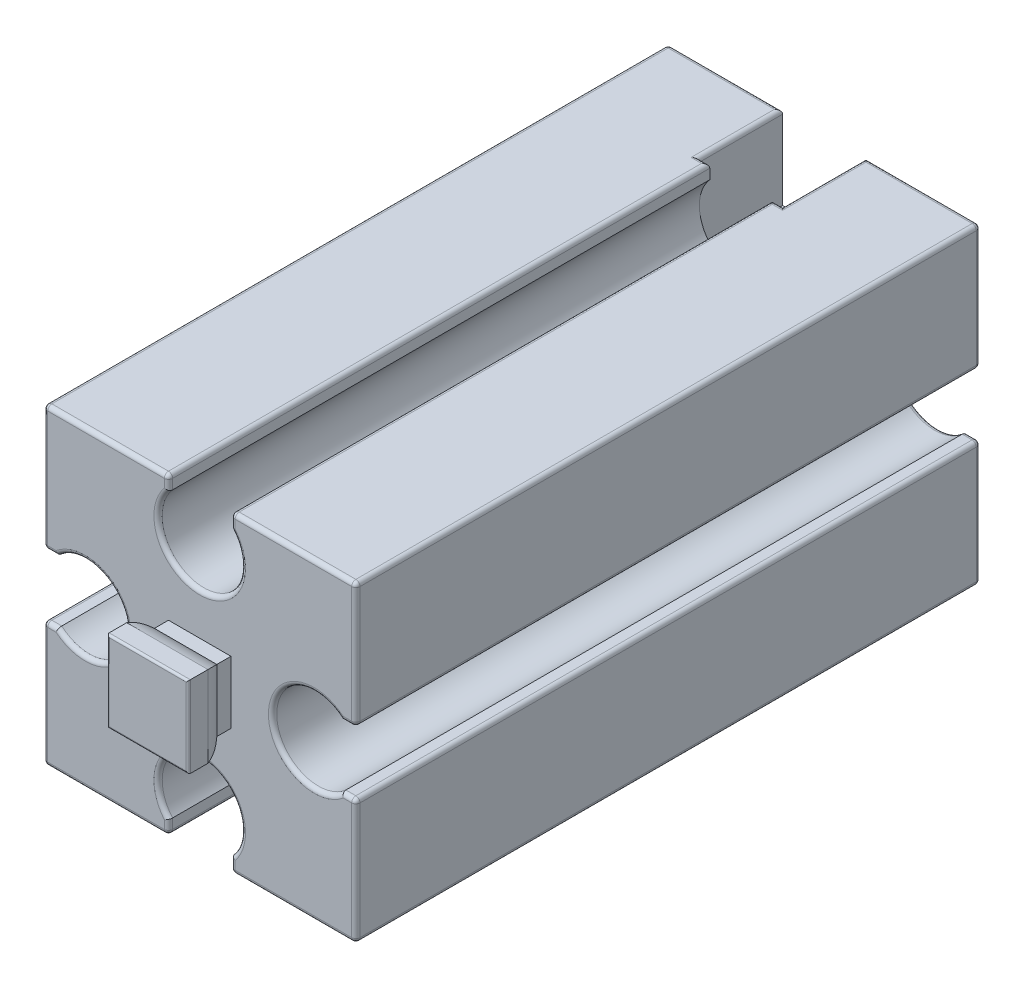
from build123d import *

# Parameters (mm, degrees)
SKETCH_1_W                      = 15
SKETCH_1_H                      = 15
EXTRUDE_1_DEPTH                 = 30
EXTRUDE_2_DEPTH                 = 1.5
EXTRUDE_2_DEPTH_BACK            = 1.5
SKETCH_2_W                      = 3
SKETCH_2_H                      = 1
EXTRUDE_3_DEPTH                 = 3
EXTRUDE_3_DEPTH_BACK            = 3
CUT_EXTRUDE_2_DEPTH             = 32.819805153
SKETCH_6_W                      = 4
SKETCH_6_H                      = 4
CUT_EXTRUDE_3_DEPTH             = 4
SKETCH_9_W                      = 4
SKETCH_9_H                      = 4
CUT_EXTRUDE_5_DEPTH             = 4
CUT_EXTRUDE_6_DEPTH             = 32.819805153
CUT_EXTRUDE_6_DEPTH_BACK        = 32.819805153
CUT_EXTRUDE_7_REACH             = 33.82
CUT_EXTRUDE_7_DIRECTION_2_REACH = 33.82
FILLET_2_R                      = 0.1
FILLET_3_R                      = 0.2


with BuildPart() as part:
    # 草图1 → 凸台-拉伸1 (new body)
    with BuildSketch(Plane.XY):
        Rectangle(SKETCH_1_W, SKETCH_1_H)
    extrude(amount=-EXTRUDE_1_DEPTH)

    # 草图2 → 凸台-拉伸2 (add, two sides: drawn at the far end of the back side and taken through both)
    with BuildSketch(Plane(origin=(0, 0, 0), x_dir=(1, 0, 0), z_dir=(0, 1, 0)).offset(-EXTRUDE_2_DEPTH_BACK)):
        with Locations((0, -0.5)):
            Rectangle(SKETCH_2_W, SKETCH_2_H)
    extrude(amount=EXTRUDE_2_DEPTH + EXTRUDE_2_DEPTH_BACK)

    # 草图3 → 凸台-拉伸3 (add, two sides: drawn at the far end of the back side and taken through both)
    with BuildSketch(Plane(origin=(0, 0, 0), x_dir=(1, 0, 0), z_dir=(0, 1, 0)).offset(-EXTRUDE_3_DEPTH_BACK)):
        with BuildLine():
            Line((-1.95, -2.5), (1.95, -2.5))
            Line((1.95, -2.5), (1.95, -1.555590279))
            ThreePointArc((1.95, -1.555590279), (1.780042303, -1.088161527), (1.5, -0.677124344))
            Line((1.5, -0.677124344), (-1.5, -0.677124344))
            ThreePointArc((-1.5, -0.677124344), (-1.780042303, -1.088161527), (-1.95, -1.555590279))
            Line((-1.95, -1.555590279), (-1.95, -2.5))
        make_face()
    extrude(amount=EXTRUDE_3_DEPTH + EXTRUDE_3_DEPTH_BACK)

    # 草图5 → 切除-拉伸2 (cut, through all)
    with BuildSketch(Plane.XY):
        with BuildLine():
            Line((-1.5, -7.5), (1.5, -7.5))
            Line((1.5, -7.5), (1.5, -6.822875656))
            ThreePointArc((1.5, -6.822875656), (0, -3.5), (-1.5, -6.822875656))
            Line((-1.5, -6.822875656), (-1.5, -7.5))
        make_face()
        with BuildLine():
            Line((1.5, 7.5), (1.5, 6.822875656))
            ThreePointArc((1.5, 6.822875656), (0, 3.5), (-1.5, 6.822875656))
            Line((-1.5, 6.822875656), (-1.5, 7.5))
            Line((-1.5, 7.5), (1.5, 7.5))
        make_face()
        with BuildLine():
            Line((-7.5, 1.5), (-6.822875656, 1.5))
            ThreePointArc((-6.822875656, 1.5), (-3.5, 0), (-6.822875656, -1.5))
            Line((-6.822875656, -1.5), (-7.5, -1.5))
            Line((-7.5, -1.5), (-7.5, 1.5))
        make_face()
        with BuildLine():
            Line((7.5, -1.5), (6.822875656, -1.5))
            ThreePointArc((6.822875656, -1.5), (3.5, 0), (6.822875656, 1.5))
            Line((6.822875656, 1.5), (7.5, 1.5))
            Line((7.5, 1.5), (7.5, -1.5))
        make_face()
    extrude(amount=-CUT_EXTRUDE_2_DEPTH, mode=Mode.SUBTRACT)

    # 草图6 → 切除-拉伸3 (cut)
    with BuildSketch(Plane(origin=(0, 7.5, 0), x_dir=(-1, 0, 0), z_dir=(0, 1, 0))):
        with Locations((0, -28)):
            Rectangle(SKETCH_6_W, SKETCH_6_H)
    extrude(amount=-CUT_EXTRUDE_3_DEPTH, mode=Mode.SUBTRACT)

    # 草图9 → 切除-拉伸5 (cut)
    with BuildSketch(Plane.XZ.offset(7.5)):
        with Locations((0, -28)):
            Rectangle(SKETCH_9_W, SKETCH_9_H)
    extrude(amount=-CUT_EXTRUDE_5_DEPTH, mode=Mode.SUBTRACT)

    # 草图11 → 切除-拉伸6 (cut, two sides: drawn at the far end of the back side and taken through both)
    with BuildSketch(Plane(origin=(0, 0, 0), x_dir=(1, 0, 0), z_dir=(0, 1, 0)).offset(-CUT_EXTRUDE_6_DEPTH_BACK)):
        with BuildLine():
            Line((-1.5, 30), (1.5, 30))
            Line((1.5, 30), (1.5, 29.322875656))
            ThreePointArc((1.5, 29.322875656), (0, 26), (-1.5, 29.322875656))
            Line((-1.5, 29.322875656), (-1.5, 30))
        make_face()
    extrude(amount=CUT_EXTRUDE_6_DEPTH + CUT_EXTRUDE_6_DEPTH_BACK, mode=Mode.SUBTRACT)

    # 草图12 → 切除-拉伸7 (cut, up to next)
    with BuildSketch(Plane(origin=(0, 0, 0), x_dir=(0, 0, -1), z_dir=(1, 0, 0)), mode=Mode.PRIVATE) as cut_extrude_7_sk1:
        with BuildLine():
            Line((-2.5, 3), (-2.5, 1.95))
            Line((-2.5, 1.95), (-1.555590279, 1.95))
            ThreePointArc((-1.555590279, 1.95), (-1.088161527, 1.780042303), (-0.677124344, 1.5))
            Line((-0.677124344, 1.5), (-0.677124344, 3))
            Line((-0.677124344, 3), (-2.5, 3))
        make_face()
    cut_extrude_7_tool1 = extrude(cut_extrude_7_sk1.sketch, amount=-CUT_EXTRUDE_7_REACH, mode=Mode.PRIVATE) & part.part
    # 草图12 → 切除-拉伸7 (cut, up to next)
    with BuildSketch(Plane(origin=(0, 0, 0), x_dir=(0, 0, -1), z_dir=(1, 0, 0)), mode=Mode.PRIVATE) as cut_extrude_7_sk2:
        with BuildLine():
            Line((-2.5, -1.95), (-1.555590279, -1.95))
            ThreePointArc((-1.555590279, -1.95), (-1.088161527, -1.780042303), (-0.677124344, -1.5))
            Line((-0.677124344, -1.5), (-0.677124344, -3))
            Line((-0.677124344, -3), (-2.5, -3))
            Line((-2.5, -3), (-2.5, -1.95))
        make_face()
    cut_extrude_7_tool2 = extrude(cut_extrude_7_sk2.sketch, amount=-CUT_EXTRUDE_7_REACH, mode=Mode.PRIVATE) & part.part
    add(cut_extrude_7_tool1.solids().sort_by_distance((0, 2.424924, 1.539049))[0], mode=Mode.SUBTRACT)
    add(cut_extrude_7_tool2.solids().sort_by_distance((0, -2.424924, 1.539049))[0], mode=Mode.SUBTRACT)

    # 草图12 → 切除-拉伸7 direction 2 (cut, up to next)
    with BuildSketch(Plane(origin=(0, 0, 0), x_dir=(0, 0, -1), z_dir=(1, 0, 0)), mode=Mode.PRIVATE) as cut_extrude_7_direction_2_sk1:
        with BuildLine():
            Line((-2.5, 3), (-2.5, 1.95))
            Line((-2.5, 1.95), (-1.555590279, 1.95))
            ThreePointArc((-1.555590279, 1.95), (-1.088161527, 1.780042303), (-0.677124344, 1.5))
            Line((-0.677124344, 1.5), (-0.677124344, 3))
            Line((-0.677124344, 3), (-2.5, 3))
        make_face()
    cut_extrude_7_direction_2_tool1 = extrude(cut_extrude_7_direction_2_sk1.sketch, amount=CUT_EXTRUDE_7_DIRECTION_2_REACH, mode=Mode.PRIVATE) & part.part
    # 草图12 → 切除-拉伸7 direction 2 (cut, up to next)
    with BuildSketch(Plane(origin=(0, 0, 0), x_dir=(0, 0, -1), z_dir=(1, 0, 0)), mode=Mode.PRIVATE) as cut_extrude_7_direction_2_sk2:
        with BuildLine():
            Line((-2.5, -1.95), (-1.555590279, -1.95))
            ThreePointArc((-1.555590279, -1.95), (-1.088161527, -1.780042303), (-0.677124344, -1.5))
            Line((-0.677124344, -1.5), (-0.677124344, -3))
            Line((-0.677124344, -3), (-2.5, -3))
            Line((-2.5, -3), (-2.5, -1.95))
        make_face()
    cut_extrude_7_direction_2_tool2 = extrude(cut_extrude_7_direction_2_sk2.sketch, amount=CUT_EXTRUDE_7_DIRECTION_2_REACH, mode=Mode.PRIVATE) & part.part
    add(cut_extrude_7_direction_2_tool1.solids().sort_by_distance((0, 2.424924, 1.539049))[0], mode=Mode.SUBTRACT)
    add(cut_extrude_7_direction_2_tool2.solids().sort_by_distance((0, -2.424924, 1.539049))[0], mode=Mode.SUBTRACT)

    # 圆角2
    fillet_2_edges = [part.edges().sort_by_distance(p)[0] for p in [
        (0, 1.95, 2.5),
        (-1.95, 0, 2.5),
        (1.95, 0, 2.5),
        (0, -1.95, 2.5),
    ]]
    fillet(fillet_2_edges, radius=FILLET_2_R)

    # 圆角3
    fillet_3_edges = [part.edges().sort_by_distance(p)[0] for p in [
        (7.5, -4.5, -30),
        (1.5, 7.5, -13),
        (-1.5, 7.5, -13),
        (-4.75, 7.5, -30),
        (-1.75, 7.5, -26),
        (-2, 7.5, -28),
        (1.75, 7.5, -26),
        (2, 7.5, -28),
        (4.75, 7.5, -30),
        (-1.5, -7.5, -13),
        (1.5, -7.5, -13),
        (4.75, -7.5, -30),
        (2, -7.5, -28),
        (1.75, -7.5, -26),
        (-1.75, -7.5, -26),
        (-2, -7.5, -28),
        (-7.5, 4.5, -30),
        (4.5, 7.5, 0),
        (7.5, -4.5, 0),
        (4.5, -7.5, 0),
        (-4.5, -7.5, 0),
        (0, -3.5, 0),
        (-1.5, -7.161437828, 0),
        (1.5, -7.161437828, 0),
        (-7.5, 4.5, 0),
        (-7.5, -4.5, -30),
        (-7.5, -4.5, 0),
        (-3.5, 0, -30),
        (-7.161437828, -1.5, -30),
        (-7.5, -1.5, -15),
        (-7.161437828, 1.5, -30),
        (-7.5, 1.5, -15),
        (-3.5, 0, 0),
        (-7.161437828, 1.5, 0),
        (-7.161437828, -1.5, 0),
        (-4.75, -7.5, -30),
        (-7.5, 7.5, -15),
        (7.5, 7.5, -15),
        (7.5, -7.5, -15),
        (-4.5, 7.5, 0),
        (-7.5, -7.5, -15),
        (0, 3.5, 0),
        (1.5, 7.161437828, 0),
        (-1.5, 7.161437828, 0),
        (7.5, 4.5, -30),
        (7.5, 4.5, 0),
        (3.5, 0, -30),
        (7.161437828, 1.5, -30),
        (7.5, 1.5, -15),
        (7.161437828, -1.5, -30),
        (7.5, -1.5, -15),
        (3.5, 0, 0),
        (7.161437828, -1.5, 0),
        (7.161437828, 1.5, 0),
    ]]
    fillet(fillet_3_edges, radius=FILLET_3_R)


solid = part.part
